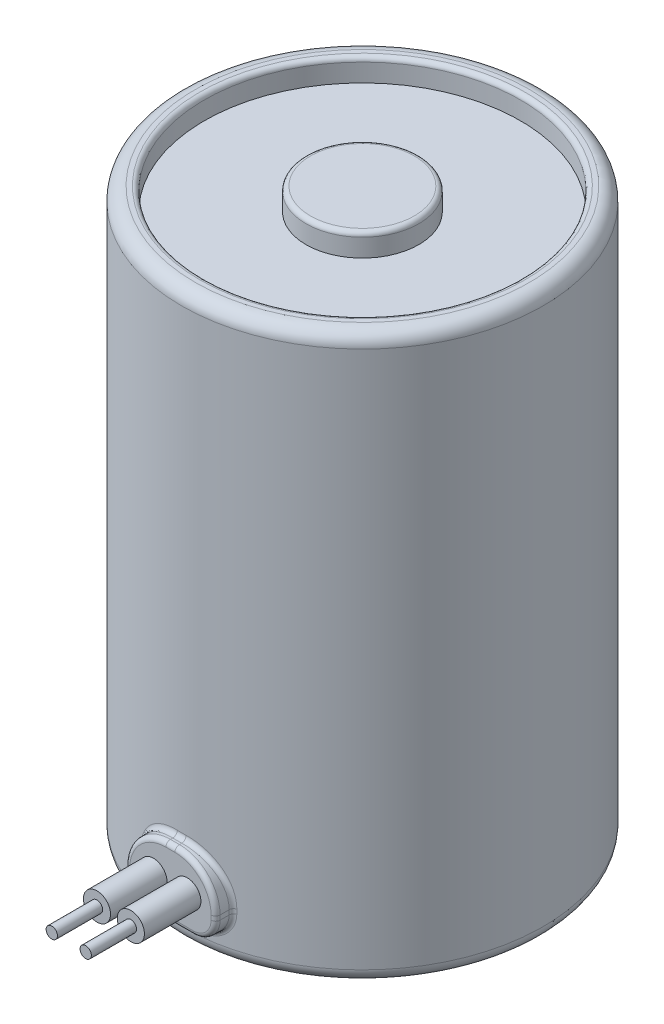
from build123d import *

# Parameters (mm, degrees)
SKETCH1_R                            = 8
BOSS_EXTRUDE1_DEPTH                  = 25
SKETCH2_R                            = 7
SKETCH2_R_2                          = 2.5
CUT_EXTRUDE1_DEPTH                   = 1
M4_TAPPED_HOLE1_D                    = 3.3
M4_TAPPED_HOLE1_DEPTH                = 6
M4_TAPPED_HOLE1_CSINK_D              = 4.5
M4_TAPPED_HOLE1_CSINK_ANGLE          = 90
M4_TAPPED_HOLE1_TIP                  = 0.952627944
BOSS_EXTRUDE2_DEPTH                  = 0.5
BOSS_EXTRUDE2_DIRECTION_2_REACH      = 32.741
BOSS_EXTRUDE2_DIRECTION_2_END_RADIUS = 8
SKETCH9_R                            = 0.6
BOSS_EXTRUDE3_DEPTH                  = 3
SKETCH10_R                           = 0.25
BOSS_EXTRUDE4_DEPTH                  = 5
FILLET1_R                            = 0.6
FILLET2_R                            = 0.2
FILLET3_R                            = 0.2
FILLET4_R                            = 0.2


with BuildPart() as part:
    # Sketch1 → Boss-Extrude1 (new body)
    with BuildSketch(Plane(origin=(0, 0, 0), x_dir=(1, 0, 0), z_dir=(0, 1, 0))):
        with Locations(Location((0, 0, 0), (0, 0, 270))):
            Circle(SKETCH1_R)
    extrude(amount=BOSS_EXTRUDE1_DEPTH)

    # Sketch2 → Cut-Extrude1 (cut)
    with BuildSketch(Plane(origin=(0, 25, 0), x_dir=(1, 0, 0), z_dir=(0, 1, 0))):
        with Locations(Location((0, 0, 0), (0, 0, 270))):
            Circle(SKETCH2_R)
        with Locations(Location((0, 0, 0), (0, 0, 270))):
            Circle(SKETCH2_R_2, mode=Mode.SUBTRACT)
    extrude(amount=-CUT_EXTRUDE1_DEPTH, mode=Mode.SUBTRACT)

    # M4 Tapped Hole1
    with Locations(Plane(origin=(0, 0, 0), x_dir=(-1, 0, 0), z_dir=(0, -1, 0))):
        with Locations((0, 0)):
            CounterSinkHole(M4_TAPPED_HOLE1_D / 2, M4_TAPPED_HOLE1_CSINK_D / 2, depth=M4_TAPPED_HOLE1_DEPTH, counter_sink_angle=M4_TAPPED_HOLE1_CSINK_ANGLE)
            with Locations((0, 0, -(M4_TAPPED_HOLE1_DEPTH + M4_TAPPED_HOLE1_TIP / 2))):  # 120° drill point
                Cone(0, M4_TAPPED_HOLE1_D / 2, M4_TAPPED_HOLE1_TIP, mode=Mode.SUBTRACT)

    # Sketch8 → Boss-Extrude2 (add)
    with BuildSketch(Plane.XY.offset(8)):
        with BuildLine():
            Line((-0.2, 4), (0.2, 4))
            ThreePointArc((0.2, 4), (1.472792206, 3.472792206), (2, 2.2))
            Line((2, 2.2), (2, 2))
            ThreePointArc((2, 2), (1.707106781, 1.292893219), (1, 1))
            Line((1, 1), (-1, 1))
            ThreePointArc((-1, 1), (-1.707106781, 1.292893219), (-2, 2))
            Line((-2, 2), (-2, 2.2))
            ThreePointArc((-2, 2.2), (-1.472792206, 3.472792206), (-0.2, 4))
        make_face()
    extrude(amount=BOSS_EXTRUDE2_DEPTH)

    # Boss-Extrude2 direction 2: up to this cylinder (the profile starts outside it)
    boss_extrude2_direction_2_end = Plane(origin=(0, 2.403845, 0), z_dir=(0, -1, 0)) * Cylinder(BOSS_EXTRUDE2_DIRECTION_2_END_RADIUS, 82.482, mode=Mode.PRIVATE)
    # Sketch8 → Boss-Extrude2 direction 2 (add, up to the surface)
    with BuildSketch(Plane.XY.offset(8), mode=Mode.PRIVATE) as boss_extrude2_direction_2_sk1:
        with BuildLine():
            Line((-0.2, 4), (0.2, 4))
            ThreePointArc((0.2, 4), (1.472792206, 3.472792206), (2, 2.2))
            Line((2, 2.2), (2, 2))
            ThreePointArc((2, 2), (1.707106781, 1.292893219), (1, 1))
            Line((1, 1), (-1, 1))
            ThreePointArc((-1, 1), (-1.707106781, 1.292893219), (-2, 2))
            Line((-2, 2), (-2, 2.2))
            ThreePointArc((-2, 2.2), (-1.472792206, 3.472792206), (-0.2, 4))
        make_face()
    boss_extrude2_direction_2_tool1 = extrude(boss_extrude2_direction_2_sk1.sketch, amount=-BOSS_EXTRUDE2_DIRECTION_2_REACH, mode=Mode.PRIVATE) - boss_extrude2_direction_2_end
    add(boss_extrude2_direction_2_tool1.solids().sort_by_distance((0, 2.403845, 8))[0])
    add(boss_extrude2_direction_2_tool1.solids().sort_by_distance((0, 2.403845, 8))[1])

    # Sketch9 → Boss-Extrude3 (add)
    with BuildSketch(Plane.XY.offset(8)):
        with Locations((-0.75, 2.5)):
            Circle(SKETCH9_R)
        with Locations(Location((0.75, 2.5, 0), (0, 0, 180))):
            Circle(SKETCH9_R)
    extrude(amount=BOSS_EXTRUDE3_DEPTH)

    # Sketch10 → Boss-Extrude4 (add)
    with BuildSketch(Plane.XY.offset(8)):
        with Locations((-0.75, 2.5)):
            Circle(SKETCH10_R)
        with Locations(Location((0.75, 2.5, 0), (0, 0, 180))):
            Circle(SKETCH10_R)
    extrude(amount=BOSS_EXTRUDE4_DEPTH)

    # Fillet1
    fillet1_edges = [part.edges().sort_by_distance(p)[0] for p in [
        (0, 0, -8),
        (0, 25, -8),
    ]]
    fillet(fillet1_edges, radius=FILLET1_R)

    # Fillet2
    fillet2_edges = [part.edges().sort_by_distance(p)[0] for p in [
        (1.705190451, 1.290982068, 7.816157978),
        (2, 2.1, 7.745966692),
        (1.472396711, 3.473187578, 7.863335674),
        (0.100007815, 4, 7.999374878),
        (-1.472396718, 3.473187586, 7.863335666),
        (-2, 2.1, 7.745966692),
        (-1.705190451, 1.290982068, 7.816157978),
        (0.5009833, 1, 7.984298074),
        (1.707106781, 1.292893219, 8.5),
        (2, 2.1, 8.5),
        (1.472792206, 3.472792206, 8.5),
        (0, 4, 8.5),
        (-1.472792206, 3.472792206, 8.5),
        (-2, 2.1, 8.5),
        (-1.707106781, 1.292893219, 8.5),
        (0, 1, 8.5),
    ]]
    fillet(fillet2_edges, radius=FILLET2_R)

    # Fillet3
    fillet3_edges = [part.edges().sort_by_distance(p)[0] for p in [
        (0, 25, -2.5),
    ]]
    fillet(fillet3_edges, radius=FILLET3_R)

    # Fillet4
    fillet4_edges = [part.edges().sort_by_distance(p)[0] for p in [
        (0, 25, -7),
    ]]
    fillet(fillet4_edges, radius=FILLET4_R)


solid = part.part
